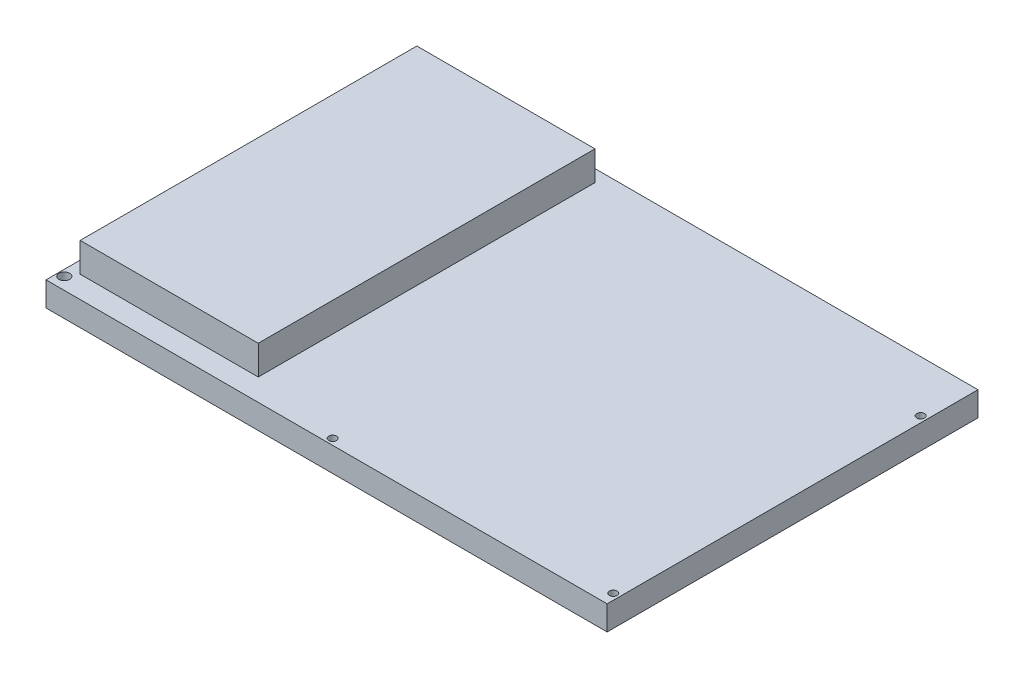
from build123d import *

# Parameters (mm, degrees)
SKETCH_2_W          = 230
SKETCH_2_H          = 152
EXTRUDE_2_DEPTH     = 10
SKETCH_3_W          = 73
SKETCH_3_H          = 138
EXTRUDE_3_DEPTH     = 12
SKETCH_4_R          = 1.6
SKETCH_4_R_2        = 2.201608842
CUT_EXTRUDE_1_DEPTH = 140.58868149


with BuildPart() as part:
    # 草图2 → 凸台-拉伸2 (new body)
    with BuildSketch(Plane(origin=(0, 0, 0), x_dir=(1, 0, 0), z_dir=(0, 1, 0))):
        Rectangle(SKETCH_2_W, SKETCH_2_H)
    extrude(amount=EXTRUDE_2_DEPTH)

    # 草图3 → 凸台-拉伸3 (add)
    with BuildSketch(Plane(origin=(0, 10, 0), x_dir=(1, 0, 0), z_dir=(0, 1, 0))):
        with Locations((-73.5, 2)):
            Rectangle(SKETCH_3_W, SKETCH_3_H)
    extrude(amount=EXTRUDE_3_DEPTH)

    # 草图4 → 切除-拉伸1 (cut, through all)
    with BuildSketch(Plane.XZ):
        with Locations((0, 73.5)):
            Circle(SKETCH_4_R)
        with Locations((112.5, -55)):
            Circle(SKETCH_4_R)
        with Locations((112.5, 71)):
            Circle(SKETCH_4_R)
        with Locations((-112.5, -51)):
            Circle(SKETCH_4_R)
        with Locations((-112.5, 71)):
            Circle(SKETCH_4_R_2)
    extrude(amount=-CUT_EXTRUDE_1_DEPTH, mode=Mode.SUBTRACT)


solid = part.part
